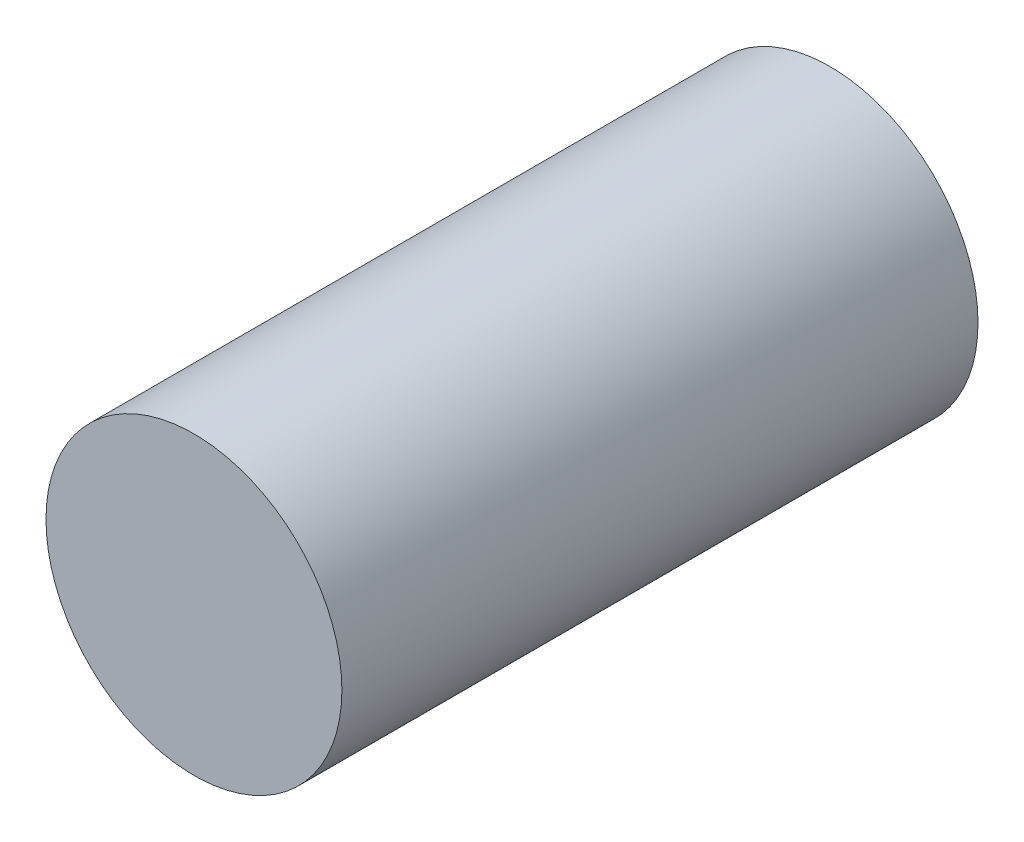
from build123d import *

# Parameters (mm, degrees)
SKETCH1_R           = 6.35
BOSS_EXTRUDE1_DEPTH = 27.3


with BuildPart() as part:
    # Sketch1 → Boss-Extrude1 (new body)
    with BuildSketch(Plane.XY):
        Circle(SKETCH1_R)
    extrude(amount=BOSS_EXTRUDE1_DEPTH)


solid = part.part
